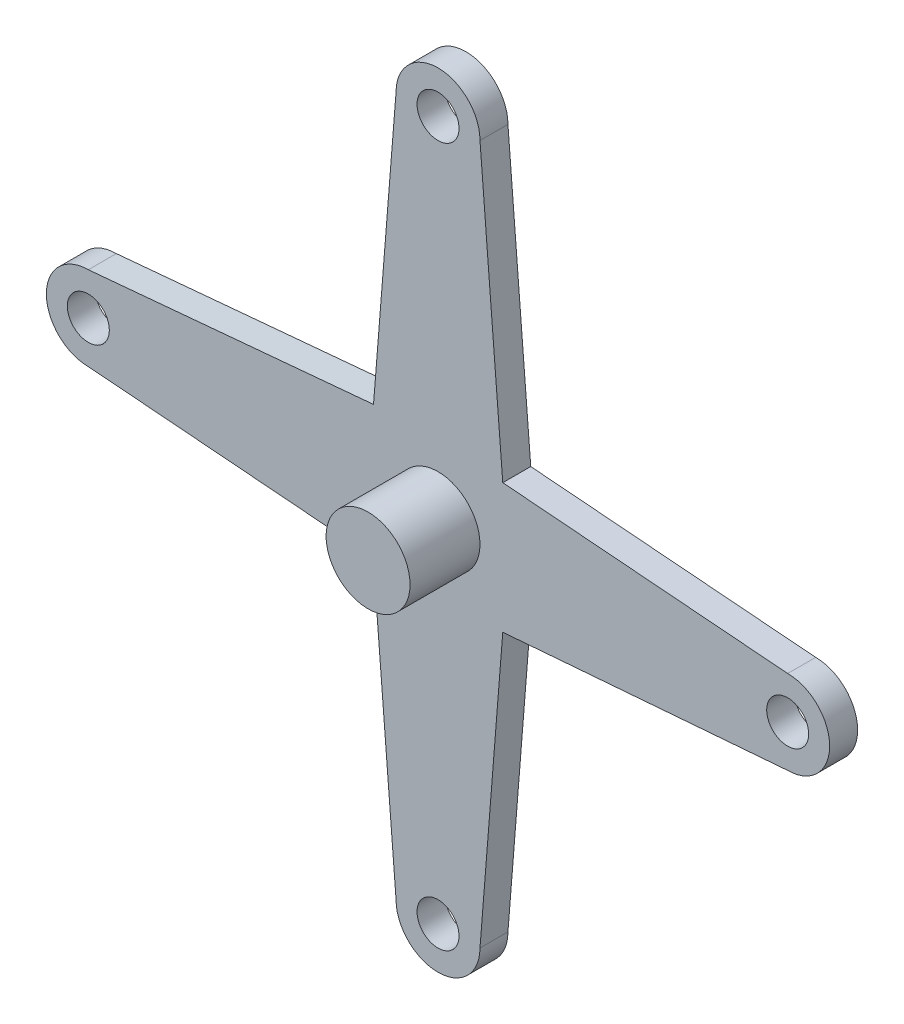
from build123d import *

# Parameters (mm, degrees)
SKETCH1_R           = 1.5
BOSS_EXTRUDE1_DEPTH = 2
SKETCH2_R           = 3
BOSS_EXTRUDE2_DEPTH = 5


with BuildPart() as part:
    # Sketch1 → Boss-Extrude1 (new body)
    with BuildSketch(Plane.XY):
        with BuildLine():
            Line((4.62962963, 4.62962963), (25, 3))
            ThreePointArc((25, 3), (28, 0), (25, -3))
            Line((25, -3), (4.62962963, -4.62962963))
            Line((4.62962963, -4.62962963), (3, -25))
            ThreePointArc((3, -25), (0, -28), (-3, -25))
            Line((-3, -25), (-4.62962963, -4.62962963))
            Line((-4.62962963, -4.62962963), (-25, -3))
            ThreePointArc((-25, -3), (-28, 0), (-25, 3))
            Line((-25, 3), (-4.611543086, 4.855711421))
            Line((-4.611543086, 4.855711421), (-3, 25))
            ThreePointArc((-3, 25), (0, 28), (3, 25))
            Line((3, 25), (4.62962963, 4.62962963))
        make_face()
        with Locations((0, 25)):
            Circle(SKETCH1_R, mode=Mode.SUBTRACT)
        with Locations((25, 0)):
            Circle(SKETCH1_R, mode=Mode.SUBTRACT)
        with Locations((0, -25)):
            Circle(SKETCH1_R, mode=Mode.SUBTRACT)
        with Locations((-25, 0)):
            Circle(SKETCH1_R, mode=Mode.SUBTRACT)
    extrude(amount=BOSS_EXTRUDE1_DEPTH)

    # Sketch2 → Boss-Extrude2 (add)
    with BuildSketch(Plane.XY.offset(2)):
        Circle(SKETCH2_R)
    extrude(amount=BOSS_EXTRUDE2_DEPTH)


solid = part.part
